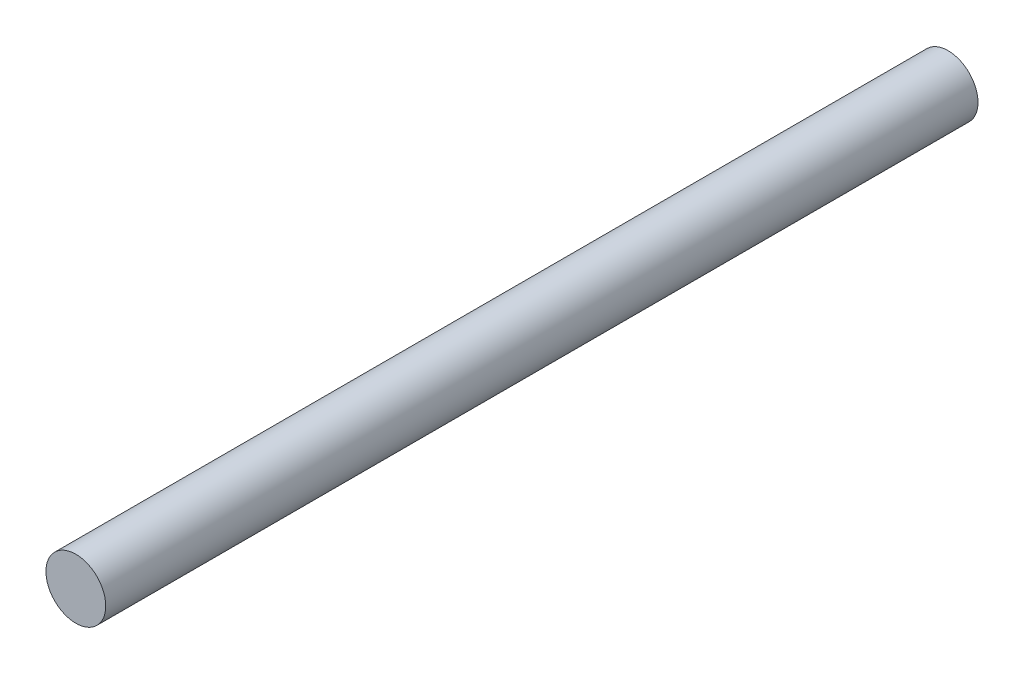
from build123d import *

# Parameters (mm, degrees)
SKETCH1_R           = 6
BOSS_EXTRUDE1_DEPTH = 175


with BuildPart() as part:
    # Sketch1 → Boss-Extrude1 (new body)
    with BuildSketch(Plane.XY):
        Circle(SKETCH1_R)
    extrude(amount=BOSS_EXTRUDE1_DEPTH)


solid = part.part
